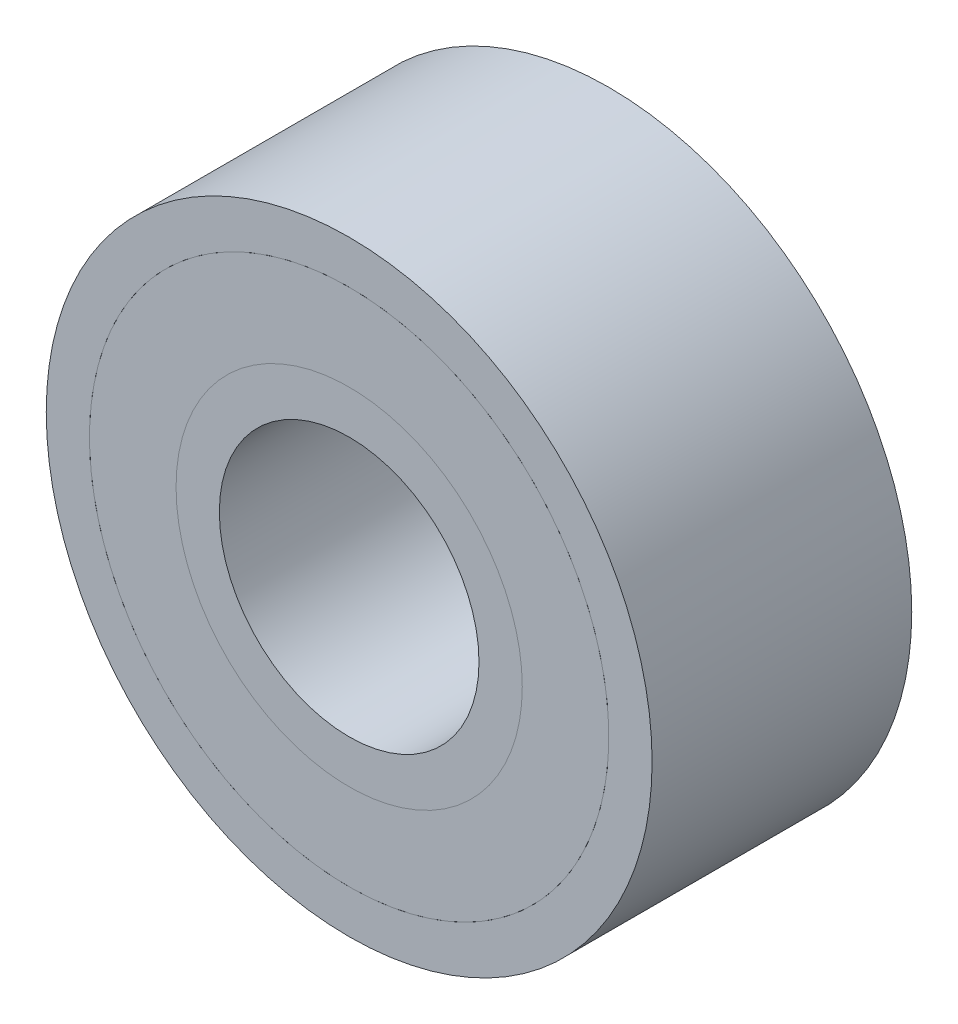
from build123d import *

# Parameters (mm, degrees)
SKIZZE1_R                       = 14
SKIZZE1_R_2                     = 6
AUFSATZ_LINEAR_AUSTRAGEN1_DEPTH = 12
SKIZZE2_R                       = 12
SKIZZE2_R_2                     = 8
SCHNITT_LINEAR_AUSTRAGEN2_DEPTH = 24.151673806
SKIZZE3_R                       = 12
SKIZZE3_R_2                     = 8
AUFSATZ_LINEAR_AUSTRAGEN3_DEPTH = 12


with BuildPart() as part:
    # Skizze1 → Aufsatz-Linear austragen1 (new body)
    with BuildSketch(Plane.XY):
        Circle(SKIZZE1_R)
        Circle(SKIZZE1_R_2, mode=Mode.SUBTRACT)
    extrude(amount=AUFSATZ_LINEAR_AUSTRAGEN1_DEPTH)

    # Skizze2 → Schnitt-Linear austragen2 (cut, through all)
    with BuildSketch(Plane(origin=(0, 0, 0), x_dir=(-1, 0, 0), z_dir=(0, 0, -1))):
        Circle(SKIZZE2_R)
        Circle(SKIZZE2_R_2, mode=Mode.SUBTRACT)
    extrude(amount=-SCHNITT_LINEAR_AUSTRAGEN2_DEPTH, mode=Mode.SUBTRACT)


with BuildPart() as schnitt_linear_austragen2_piece_1:
    # of the separate pieces the step leaves, piece 1, a body of its own (schnitt_linear_austragen2_pieces)
    add(part.part.solids().sort_by_distance((14, 0, 0))[0])


with BuildPart() as schnitt_linear_austragen2_piece_2:
    # of the separate pieces the step leaves, piece 2, a body of its own (schnitt_linear_austragen2_pieces)
    add(part.part.solids().sort_by_distance((-8, 0, 0))[0])


with BuildPart() as body_3:
    # Skizze3 → Aufsatz-Linear austragen3 (new body)
    with BuildSketch(Plane.XY):
        Circle(SKIZZE3_R)
        Circle(SKIZZE3_R_2, mode=Mode.SUBTRACT)
    extrude(amount=AUFSATZ_LINEAR_AUSTRAGEN3_DEPTH)


solid = Compound([schnitt_linear_austragen2_piece_1.part, schnitt_linear_austragen2_piece_2.part, body_3.part])
